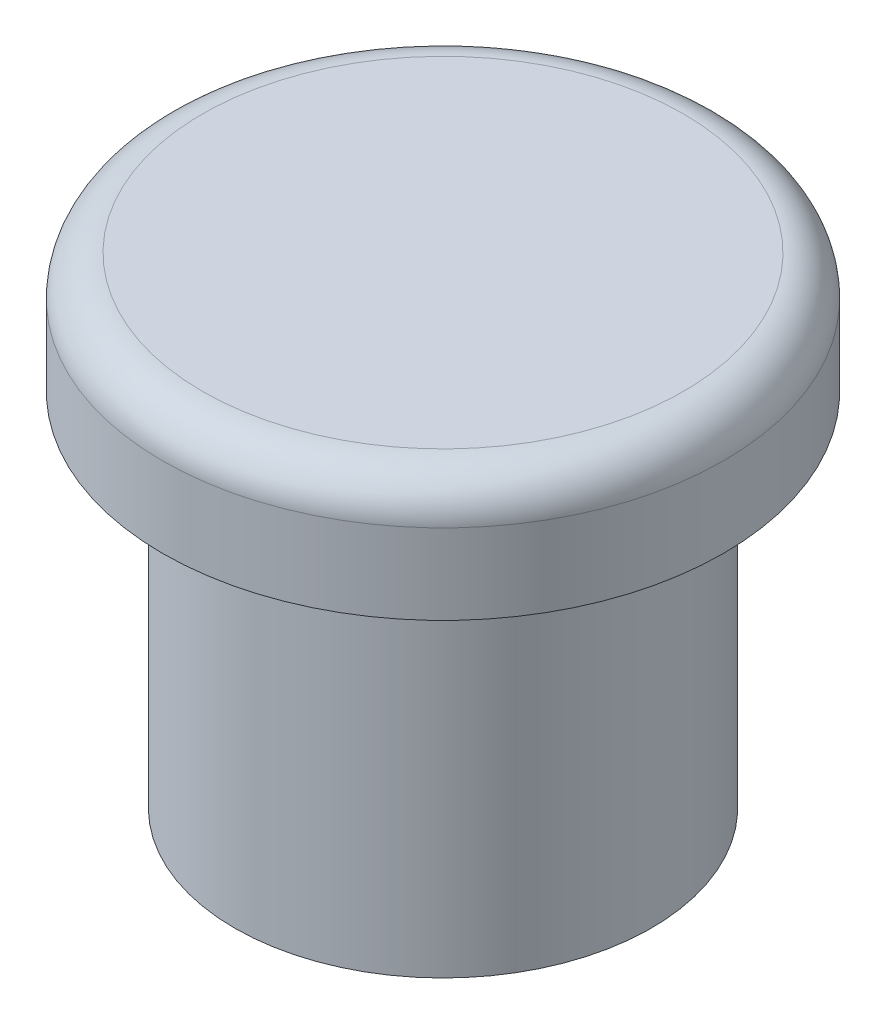
from build123d import *

# Parameters (mm, degrees)
SKETCH1_R           = 2.6
SKETCH1_R_2         = 1.95
BOSS_EXTRUDE1_DEPTH = 4.5
SKETCH2_R           = 3.5
BOSS_EXTRUDE2_DEPTH = 1.5
FILLET1_R           = 0.5


with BuildPart() as part:
    # Sketch1 → Boss-Extrude1 (new body)
    with BuildSketch(Plane(origin=(0, 0, 0), x_dir=(1, 0, 0), z_dir=(0, 1, 0))):
        with Locations(Location((0, 0, 0), (0, 0, 270))):
            Circle(SKETCH1_R)
        with Locations(Location((0, 0, 0), (0, 0, 270))):
            Circle(SKETCH1_R_2, mode=Mode.SUBTRACT)
    extrude(amount=BOSS_EXTRUDE1_DEPTH)

    # Sketch2 → Boss-Extrude2 (add)
    with BuildSketch(Plane(origin=(0, 4.5, 0), x_dir=(1, 0, 0), z_dir=(0, 1, 0))):
        with Locations(Location((0, 0, 0), (0, 0, 270))):
            Circle(SKETCH2_R)
    extrude(amount=BOSS_EXTRUDE2_DEPTH)

    # Fillet1
    fillet1_edges = [part.edges().sort_by_distance(p)[0] for p in [
        (0, 6, -3.5),
    ]]
    fillet(fillet1_edges, radius=FILLET1_R)


solid = part.part
